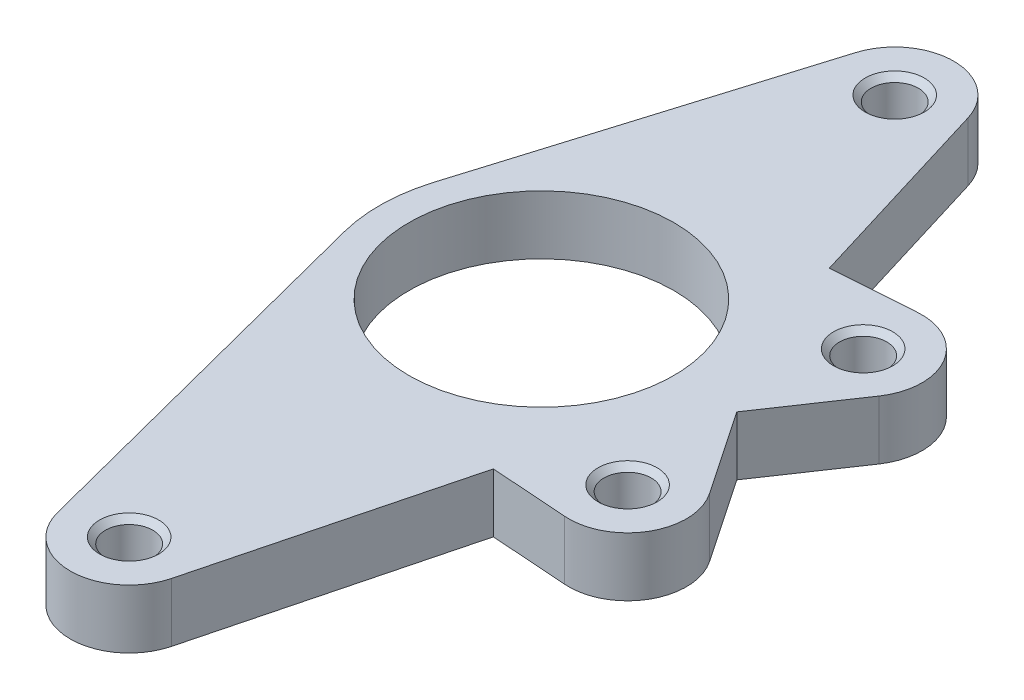
from build123d import *

# Parameters (mm, degrees)
SKETCH1_R                       = 14.2875
BOSS_EXTRUDE1_DEPTH             = 6.35
F_10_CLEARANCE_HOLE1_AT_2_COUNT = 2
F_10_CLEARANCE_HOLE1_AT_2_PITCH = 38.625542067
F_10_CLEARANCE_HOLE1_AT_3_COUNT = 2
F_10_CLEARANCE_HOLE1_AT_3_PITCH = 61.237182332
F_10_CLEARANCE_HOLE1_AT_4_COUNT = 2
F_10_CLEARANCE_HOLE1_AT_4_PITCH = 82.55


with BuildPart() as part:
    # Sketch1 → Boss-Extrude1 (new body)
    with BuildSketch(Plane(origin=(0, 0, 0), x_dir=(1, 0, 0), z_dir=(0, 1, 0))):
        with BuildLine():
            Line((-16.703230912, 5.093229167), (-6.07390215, 39.952083333))
            ThreePointArc((-6.07390215, 39.952083333), (0, 44.45), (6.07390215, 39.952083333))
            Line((6.07390215, 39.952083333), (12.644794548, 18.402859955))
            Line((12.644794548, 18.402859955), (21.547953627, 19.034099518))
            ThreePointArc((21.547953627, 19.034099518), (27.49630657, 15.875), (27.257990535, 9.144025482))
            Line((27.257990535, 9.144025482), (21.077367113, 0))
            Line((21.077367113, 0), (27.257990535, -9.144025482))
            ThreePointArc((27.257990535, -9.144025482), (27.49630657, -15.875), (21.547953627, -19.034099518))
            Line((21.547953627, -19.034099518), (13.272110504, -18.44733705))
            Line((13.272110504, -18.44733705), (6.148361062, -46.0375))
            ThreePointArc((6.148361062, -46.0375), (0, -50.8), (-6.148361062, -46.0375))
            Line((-6.148361062, -46.0375), (-16.907992921, -4.365625))
            ThreePointArc((-16.907992921, -4.365625), (-17.458409791, 0.377933626), (-16.703230912, 5.093229167))
        make_face()
        with Locations(Location((0, 0, 0), (0, 0, 270))):
            Circle(SKETCH1_R, mode=Mode.SUBTRACT)
    extrude(amount=BOSS_EXTRUDE1_DEPTH)

    # Sketch3 → #10 Clearance Hole1 (revolve, cut)
    with BuildSketch(Plane(origin=(0, 6.35, 44.45), x_dir=(0, 0, 1), z_dir=(1, 0, 0))):
        Polygon((0, 0), (0, 6.35), (3.1877, 6.35), (2.5527, 5.715), (2.5527, 0.635), (3.1877, 0), align=None)
    f_10_clearance_hole1 = revolve(axis=Axis((0, 12.7, 44.45), (0, -1, 0)), mode=Mode.SUBTRACT)

    # #10 Clearance Hole1 at 2: #10 Clearance Hole1 ×2
    with Locations(*[Vector(0.5694947974514997, 0, -0.8219949365267863) * (i * F_10_CLEARANCE_HOLE1_AT_2_PITCH) for i in range(1, F_10_CLEARANCE_HOLE1_AT_2_COUNT)]):
        add(f_10_clearance_hole1, mode=Mode.SUBTRACT)

    # #10 Clearance Hole1 at 3: #10 Clearance Hole1 ×2
    with Locations(*[Vector(0.3592106040535505, 0, -0.9332565252573826) * (i * F_10_CLEARANCE_HOLE1_AT_3_PITCH) for i in range(1, F_10_CLEARANCE_HOLE1_AT_3_COUNT)]):
        add(f_10_clearance_hole1, mode=Mode.SUBTRACT)

    # #10 Clearance Hole1 at 4: #10 Clearance Hole1 ×2
    with Locations(*[(0, 0, -i * F_10_CLEARANCE_HOLE1_AT_4_PITCH) for i in range(1, F_10_CLEARANCE_HOLE1_AT_4_COUNT)]):
        add(f_10_clearance_hole1, mode=Mode.SUBTRACT)


solid = part.part
